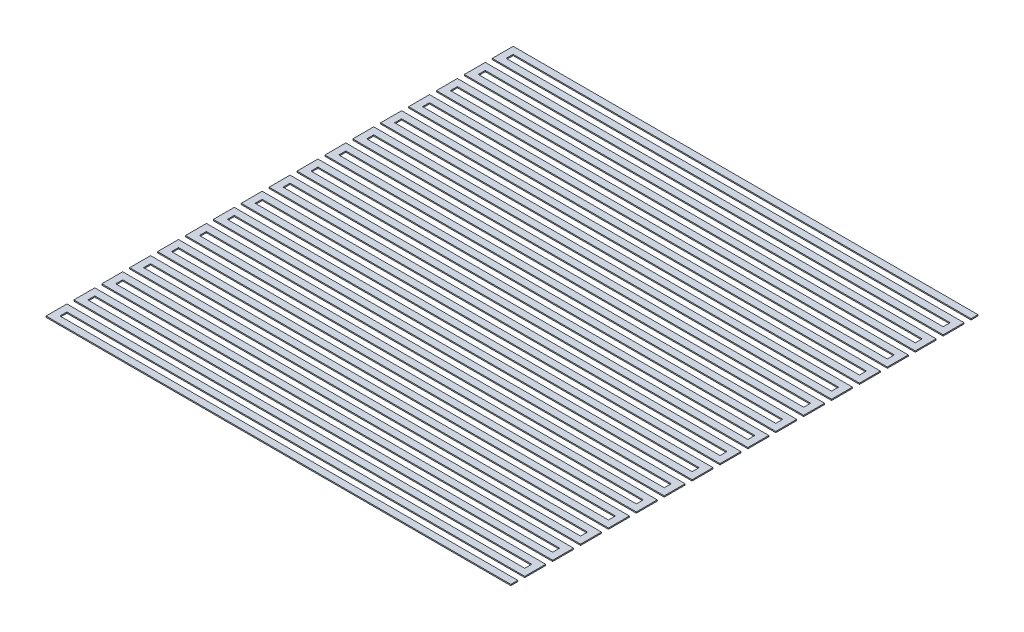
from build123d import *

# Parameters (mm, degrees)
EXTRUDED_OBJECT_DEPTH = 0.05
BOSS_EXTRUDE1_DEPTH   = 0.05
LPATTERN1_COUNT       = 16
LPATTERN1_PITCH       = 1.2


with BuildPart() as part:
    # TopBlock → Extruded object (new body)
    with BuildSketch(Plane(origin=(0, 0, 0), x_dir=(1, 0, 0), z_dir=(0, 1, 0))):
        Polygon((-10, 10), (-9.7, 10), (10, 10), (10, 9.7), (-9.7, 9.7), (-9.7, 9.4), (10, 9.4), (10, 9.1), (-10, 9.1), (-10, 9.4), (-10, 9.7), align=None)
    extrude(amount=EXTRUDED_OBJECT_DEPTH)

    # Sketch2 → Boss-Extrude1 (add)
    with BuildSketch(Plane(origin=(0, 0, 0), x_dir=(1, 0, 0), z_dir=(0, 1, 0))):
        Polygon((10, 9.1), (10, 8.8), (10, 8.5), (-9.7, 8.5), (-9.7, 8.2), (10, 8.2), (10, 7.9), (-10, 7.9), (-10, 8.2), (-10, 8.5), (-10, 8.8), (9.7, 8.8), (9.7, 9.1), align=None)
    boss_extrude1 = extrude(amount=BOSS_EXTRUDE1_DEPTH)

    # LPattern1: Boss-Extrude1 ×16
    with Locations(*[(0, 0, i * LPATTERN1_PITCH) for i in range(1, LPATTERN1_COUNT)]):
        add(boss_extrude1)


solid = part.part
